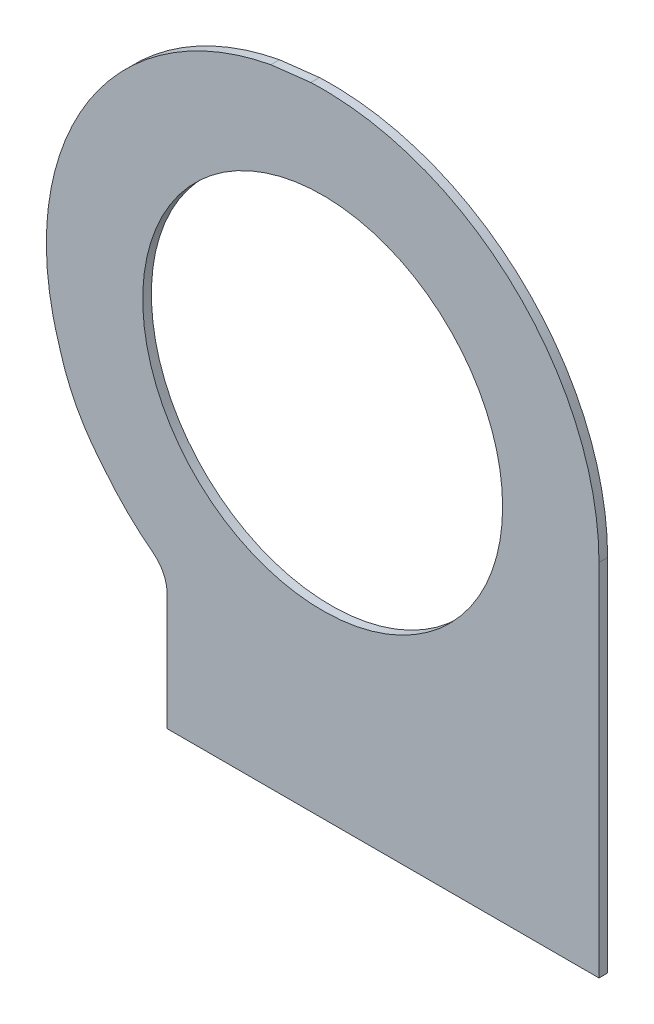
from build123d import *

# Parameters (mm, degrees)
SKETCH1_R           = 25
BOSS_EXTRUDE2_DEPTH = 1.2


with BuildPart() as part:
    # Sketch1 → Boss-Extrude2 (new body)
    with BuildSketch(Plane.XY):
        with BuildLine():
            ThreePointArc((30.012612552, 44.909806232), (31.456939617, 43.153429969), (31.974033442, 40.939033386))
            Line((31.974033442, 40.939033386), (31.974033442, 24.710911787))
            Line((31.974033442, 24.710911787), (91.973979472, 24.710911787))
            Line((91.973979472, 24.710911787), (91.974010458, 74.710883533))
            add(Edge.make_bspline(
                [(91.974010458, 74.710883533), (91.974034887, 114.130812003), (51.933054654, 112.434101318)],
                knots=[0, 0, 0, 1.61385221, 1.61385221, 1.61385221], degree=2, weights=[1, 0.691721555, 1]))
            Line((51.933054654, 112.434101318), (46.381981502, 111.79839875))
            add(Edge.make_bspline(
                [(46.381981502, 111.79839875), (3.982488462, 103.83150821), (16.977674359, 63.34382334)],
                knots=[4.901152551, 4.901152551, 4.901152551, 6.588978479, 6.588978479, 6.588978479], degree=2, weights=[1, 0.664543961, 1]))
            ThreePointArc((16.977674359, 63.34382334), (17.041173685, 63.129657728), (17.095043921, 62.912869648))
            add(Edge.make_bspline(
                [(17.095043921, 62.912869648), (18.7559158, 56.98560233), (22.647992265, 52.31328285)],
                knots=[0.033678654, 0.033678654, 0.033678654, 0.963651852, 0.963651852, 0.963651852], degree=2))
            ThreePointArc((22.647992265, 52.31328285), (22.806145611, 52.135286834), (22.955645602, 51.949963291))
            add(Edge.make_bspline(
                [(22.955645602, 51.949963291), (26.0115243, 47.971583788), (30.012612552, 44.909806232)],
                knots=[0.647016148, 0.647016148, 0.647016148, 0.90960641, 0.90960641, 0.90960641], degree=2, weights=[1, 0.991393169, 1]))
        make_face()
        with Locations((53.585400153, 74.710911787)):
            Circle(SKETCH1_R, mode=Mode.SUBTRACT)
    extrude(amount=BOSS_EXTRUDE2_DEPTH)


solid = part.part
